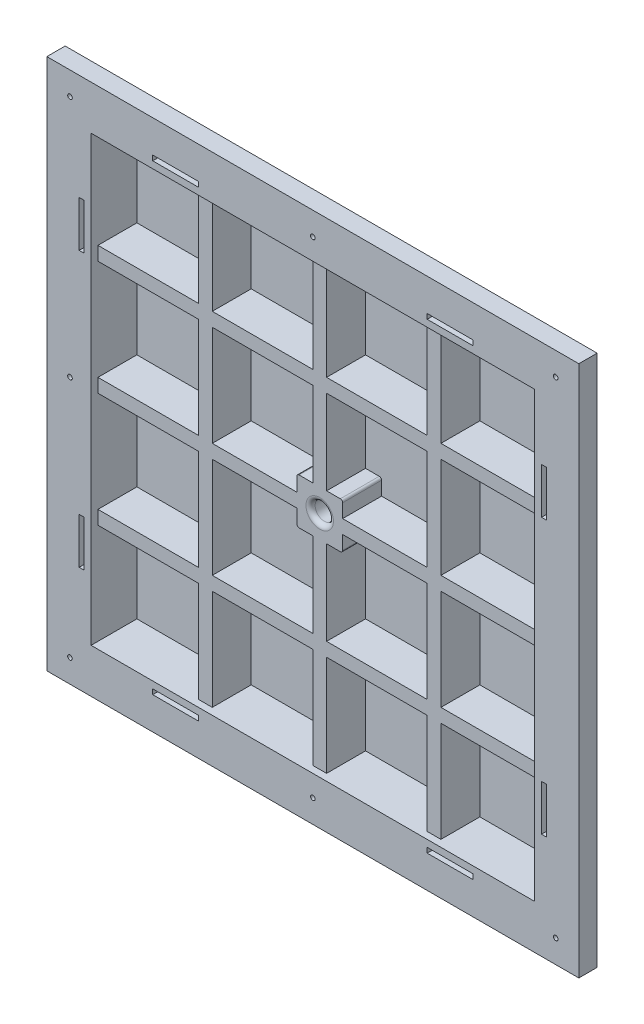
from build123d import *

# Parameters (mm, degrees)
SKETCH1_W           = 199.6
SKETCH1_H           = 199.6
BOSS_EXTRUDE1_DEPTH = 20
SKETCH2_W           = 226.2
SKETCH2_H           = 226.2
SKETCH2_W_2         = 220.2
SKETCH2_H_2         = 220.2
BOSS_EXTRUDE2_DEPTH = 5
SKETCH3_W           = 43.9
SKETCH3_H           = 43.9
CUT_EXTRUDE2_DEPTH  = 17
SKETCH4_W           = 226.2
SKETCH4_H           = 226.2
SKETCH4_R           = 1
SKETCH4_W_2         = 193.6
SKETCH4_H_2         = 193.6
BOSS_EXTRUDE3_DEPTH = 3
SKETCH5_W           = 20
SKETCH5_H           = 2.2
SKETCH5_W_2         = 2.2
SKETCH5_H_2         = 20
CUT_EXTRUDE3_DEPTH  = 1332.979018481
SKETCH6_W           = 232.2
SKETCH6_H           = 232.2
SKETCH6_W_2         = 226.2
SKETCH6_H_2         = 226.2
BOSS_EXTRUDE4_DEPTH = 8
BOSS_EXTRUDE5_DEPTH = 20
SKETCH8_R           = 4
CUT_EXTRUDE4_DEPTH  = 1337.192961728
FILLET1_R           = 2
FILLET2_R           = 1
SKETCH9_W           = 220.5
SKETCH9_H           = 220.5
SKETCH9_W_2         = 199.6
SKETCH9_H_2         = 199.6
CUT_EXTRUDE5_DEPTH  = 5
FILLET4_R           = 2


with BuildPart() as part:
    # Sketch1 → Boss-Extrude1 (new body)
    with BuildSketch(Plane.XY.offset(1355.724355858)):
        with Locations((713.742691035, 930.978191495)):
            Rectangle(SKETCH1_W, SKETCH1_H)
    extrude(amount=-BOSS_EXTRUDE1_DEPTH)

    # Sketch3 → Cut-Extrude2 (cut)
    with BuildSketch(Plane.XY.offset(1355.724355858)):
        with Locations((638.892691035, 906.028191495)):
            Rectangle(SKETCH3_W, SKETCH3_H)
        with Locations((638.892691035, 955.928191495)):
            Rectangle(SKETCH3_W, SKETCH3_H)
        with Locations((638.892691035, 856.128191495)):
            Rectangle(SKETCH3_W, SKETCH3_H)
        with Locations((788.592691035, 856.128191495)):
            Rectangle(SKETCH3_W, SKETCH3_H)
        with Locations((788.592691035, 1005.828191495)):
            Rectangle(SKETCH3_W, SKETCH3_H)
        with Locations((638.892691035, 1005.828191495)):
            Rectangle(SKETCH3_W, SKETCH3_H)
        with Locations((688.792691035, 1005.828191495)):
            Rectangle(SKETCH3_W, SKETCH3_H)
        with Locations((738.692691035, 1005.828191495)):
            Rectangle(SKETCH3_W, SKETCH3_H)
        with Locations((738.692691035, 955.928191495)):
            Rectangle(SKETCH3_W, SKETCH3_H)
        with Locations((688.792691035, 906.028191495)):
            Rectangle(SKETCH3_W, SKETCH3_H)
        with Locations((738.692691035, 906.028191495)):
            Rectangle(SKETCH3_W, SKETCH3_H)
        with Locations((688.792691035, 955.928191495)):
            Rectangle(SKETCH3_W, SKETCH3_H)
        with Locations((788.592691035, 955.928191495)):
            Rectangle(SKETCH3_W, SKETCH3_H)
        with Locations((738.692691035, 856.128191495)):
            Rectangle(SKETCH3_W, SKETCH3_H)
        with Locations((788.592691035, 906.028191495)):
            Rectangle(SKETCH3_W, SKETCH3_H)
        with Locations((688.792691035, 856.128191495)):
            Rectangle(SKETCH3_W, SKETCH3_H)
    extrude(amount=-CUT_EXTRUDE2_DEPTH, mode=Mode.SUBTRACT)



with BuildPart() as body_2:
    # Sketch2 → Boss-Extrude2 (new body)
    with BuildSketch(Plane.XY.offset(1355.724355858)):
        with Locations((713.742691035, 930.978191495)):
            Rectangle(SKETCH2_W, SKETCH2_H)
        with Locations((713.742691035, 930.978191495)):
            Rectangle(SKETCH2_W_2, SKETCH2_H_2, mode=Mode.SUBTRACT)
    extrude(amount=-BOSS_EXTRUDE2_DEPTH)


with BuildPart() as part_1:
    add(part.part)

    add(body_2.part)  # Boss-Extrude3 merges body 2
    # Sketch4 → Boss-Extrude3 (add)
    with BuildSketch(Plane.XY.offset(1355.724355858)):
        with Locations((713.742691035, 930.978191495)):
            Rectangle(SKETCH4_W, SKETCH4_H)
        with Locations((607.742691035, 1036.978191495)):
            Circle(SKETCH4_R, mode=Mode.SUBTRACT)
        with Locations((713.742691035, 1036.978191495)):
            Circle(SKETCH4_R, mode=Mode.SUBTRACT)
        with Locations((819.742691035, 1036.978191495)):
            Circle(SKETCH4_R, mode=Mode.SUBTRACT)
        with Locations((607.742691035, 930.978191495)):
            Circle(SKETCH4_R, mode=Mode.SUBTRACT)
        with Locations((607.742691035, 824.978191495)):
            Circle(SKETCH4_R, mode=Mode.SUBTRACT)
        with Locations((713.742691035, 824.978191495)):
            Circle(SKETCH4_R, mode=Mode.SUBTRACT)
        with Locations((819.742691035, 824.978191495)):
            Circle(SKETCH4_R, mode=Mode.SUBTRACT)
        with Locations((713.742691035, 930.978191495)):
            Rectangle(SKETCH4_W_2, SKETCH4_H_2, mode=Mode.SUBTRACT)
    extrude(amount=BOSS_EXTRUDE3_DEPTH)

    # Sketch5 → Cut-Extrude3 (cut, through all)
    with BuildSketch(Plane(origin=(0, 0, 1355.724355858), x_dir=(-1, 0, 0), z_dir=(0, 0, -1))):
        with Locations((-773.642691035, 1031.878191495)):
            Rectangle(SKETCH5_W, SKETCH5_H)
        with Locations((-773.642691035, 830.078191495)):
            Rectangle(SKETCH5_W, SKETCH5_H)
        with Locations((-653.842691035, 830.078191495)):
            Rectangle(SKETCH5_W, SKETCH5_H)
        with Locations((-653.842691035, 1031.878191495)):
            Rectangle(SKETCH5_W, SKETCH5_H)
        with Locations((-814.642691035, 871.078191495)):
            Rectangle(SKETCH5_W_2, SKETCH5_H_2)
        with Locations((-814.642691035, 990.878191495)):
            Rectangle(SKETCH5_W_2, SKETCH5_H_2)
        with Locations((-612.842691035, 990.878191495)):
            Rectangle(SKETCH5_W_2, SKETCH5_H_2)
        with Locations((-612.842691035, 871.078191495)):
            Rectangle(SKETCH5_W_2, SKETCH5_H_2)
    extrude(amount=-CUT_EXTRUDE3_DEPTH, mode=Mode.SUBTRACT)

    # Sketch6 → Boss-Extrude4 (add)
    with BuildSketch(Plane.XY.offset(1358.724355858)):
        with Locations((713.742691035, 930.978191495)):
            Rectangle(SKETCH6_W, SKETCH6_H)
        with Locations((713.742691035, 930.978191495)):
            Rectangle(SKETCH6_W_2, SKETCH6_H_2, mode=Mode.SUBTRACT)
    extrude(amount=-BOSS_EXTRUDE4_DEPTH)

    # Sketch7 → Boss-Extrude5 (add)
    with BuildSketch(Plane.XY.offset(1355.724355858)):
        Polygon((703.742691035, 930.978191495), (703.742691035, 940.978191495), (723.742691035, 940.978191495), (723.742691035, 920.978191495), (703.742691035, 920.978191495), align=None)
    extrude(amount=-BOSS_EXTRUDE5_DEPTH)

    # Sketch8 → Cut-Extrude4 (cut, through all)
    with BuildSketch(Plane.XY.offset(1355.724355858)):
        with Locations((713.742691035, 930.978191495)):
            Circle(SKETCH8_R)
    extrude(amount=-CUT_EXTRUDE4_DEPTH, mode=Mode.SUBTRACT)

    # Fillet1
    fillet1_edges = [part_1.edges().sort_by_distance(p)[0] for p in [
        (709.742691035, 930.978191495, 1355.724355858),
    ]]
    fillet(fillet1_edges, radius=FILLET1_R)

    # Fillet2
    fillet2_edges = [part_1.edges().sort_by_distance(p)[0] for p in [
        (703.742691035, 940.978191495, 1347.224355858),
        (723.742691035, 940.978191495, 1347.224355858),
        (723.742691035, 920.978191495, 1347.224355858),
        (703.742691035, 920.978191495, 1347.224355858),
    ]]
    fillet(fillet2_edges, radius=FILLET2_R)

    # Sketch9 → Cut-Extrude5 (cut)
    with BuildSketch(Plane(origin=(0, 0, 1350.724355858), x_dir=(-1, 0, 0), z_dir=(0, 0, -1))):
        with Locations((-713.742691035, 930.978191495)):
            Rectangle(SKETCH9_W, SKETCH9_H)
        with Locations((-713.742691035, 930.978191495)):
            Rectangle(SKETCH9_W_2, SKETCH9_H_2, mode=Mode.SUBTRACT)
    extrude(amount=-CUT_EXTRUDE5_DEPTH, mode=Mode.SUBTRACT)

    # Fillet4
    fillet4_edges = [part_1.edges().sort_by_distance(p)[0] for p in [
        (713.742691035, 820.728191495, 1350.724355858),
        (603.492691035, 930.978191495, 1350.724355858),
        (713.742691035, 1041.228191495, 1350.724355858),
        (823.992691035, 930.978191495, 1350.724355858),
    ]]
    fillet(fillet4_edges, radius=FILLET4_R)


solid = part_1.part
